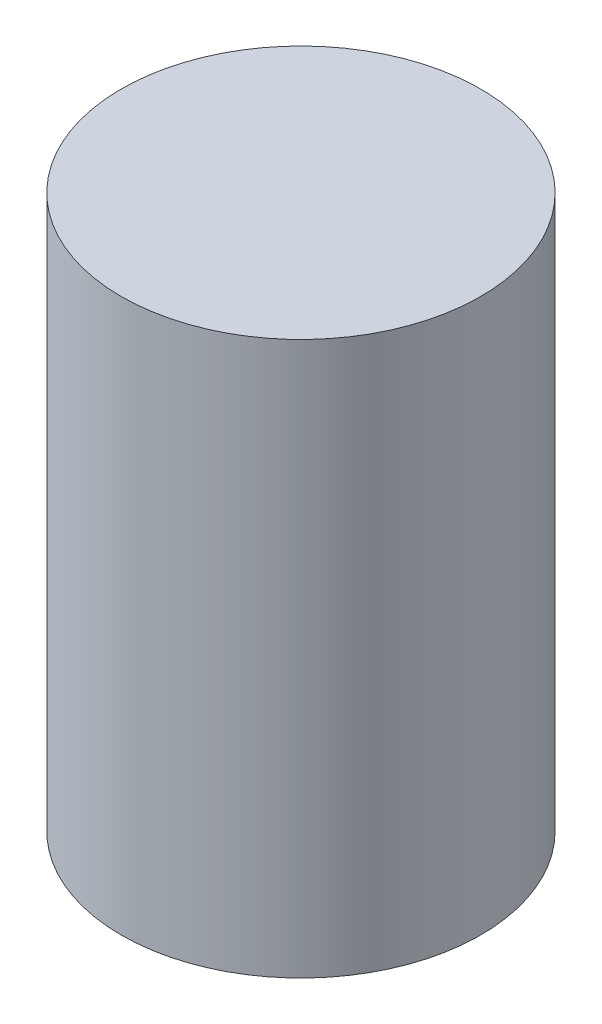
from build123d import *

# Parameters (mm, degrees)
SKETCH1_R           = 3.9
BOSS_EXTRUDE1_DEPTH = 12


with BuildPart() as part:
    # Sketch1 → Boss-Extrude1 (new body)
    with BuildSketch(Plane(origin=(0, 0, 0), x_dir=(1, 0, 0), z_dir=(0, 1, 0))):
        with Locations(Location((0, 0, 0), (0, 0, 270))):
            Circle(SKETCH1_R)
    extrude(amount=BOSS_EXTRUDE1_DEPTH)


solid = part.part
